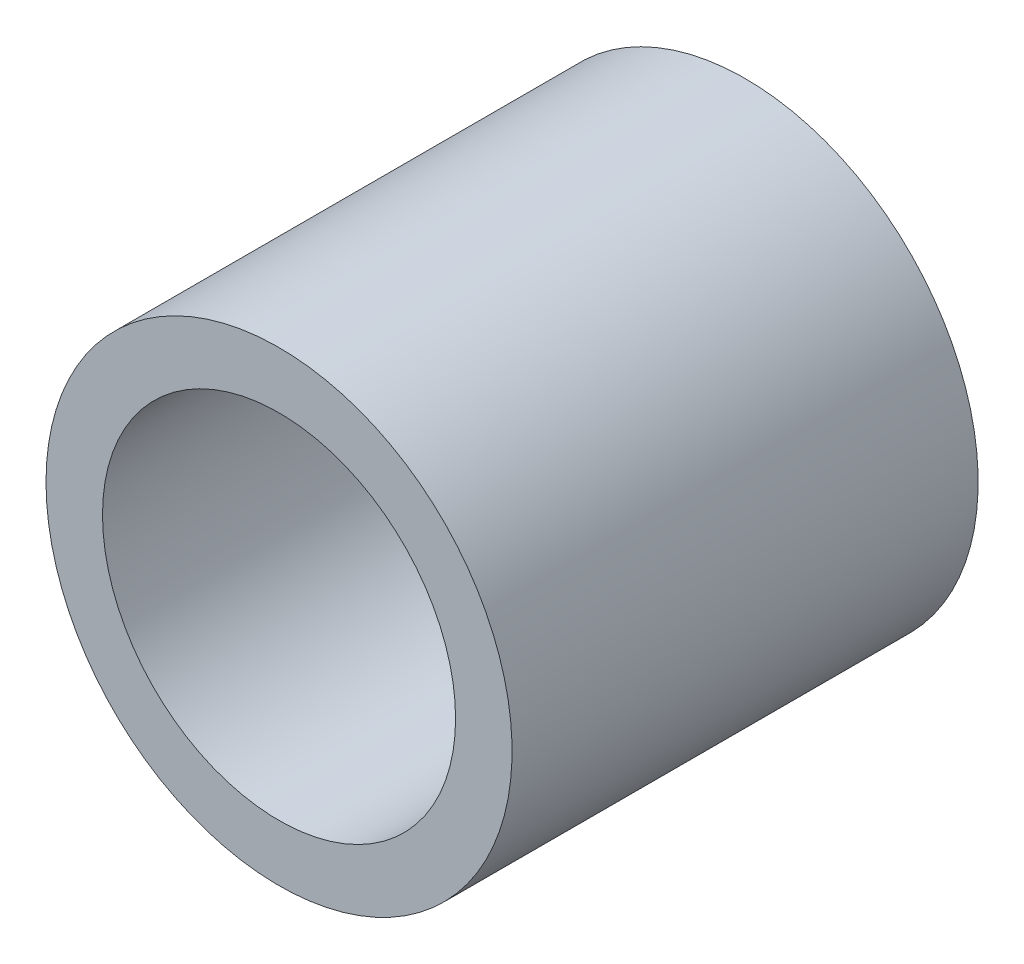
from build123d import *

# Parameters (mm, degrees)
SKETCH1_R           = 4.95
SKETCH1_R_2         = 3.75
BOSS_EXTRUDE1_DEPTH = 9.9


with BuildPart() as part:
    # Sketch1 → Boss-Extrude1 (new body)
    with BuildSketch(Plane.XY):
        with Locations(Location((0, 0, 0), (0, 0, 180))):
            Circle(SKETCH1_R)
        with Locations(Location((0, 0, 0), (0, 0, 180))):
            Circle(SKETCH1_R_2, mode=Mode.SUBTRACT)
    extrude(amount=BOSS_EXTRUDE1_DEPTH)


solid = part.part
